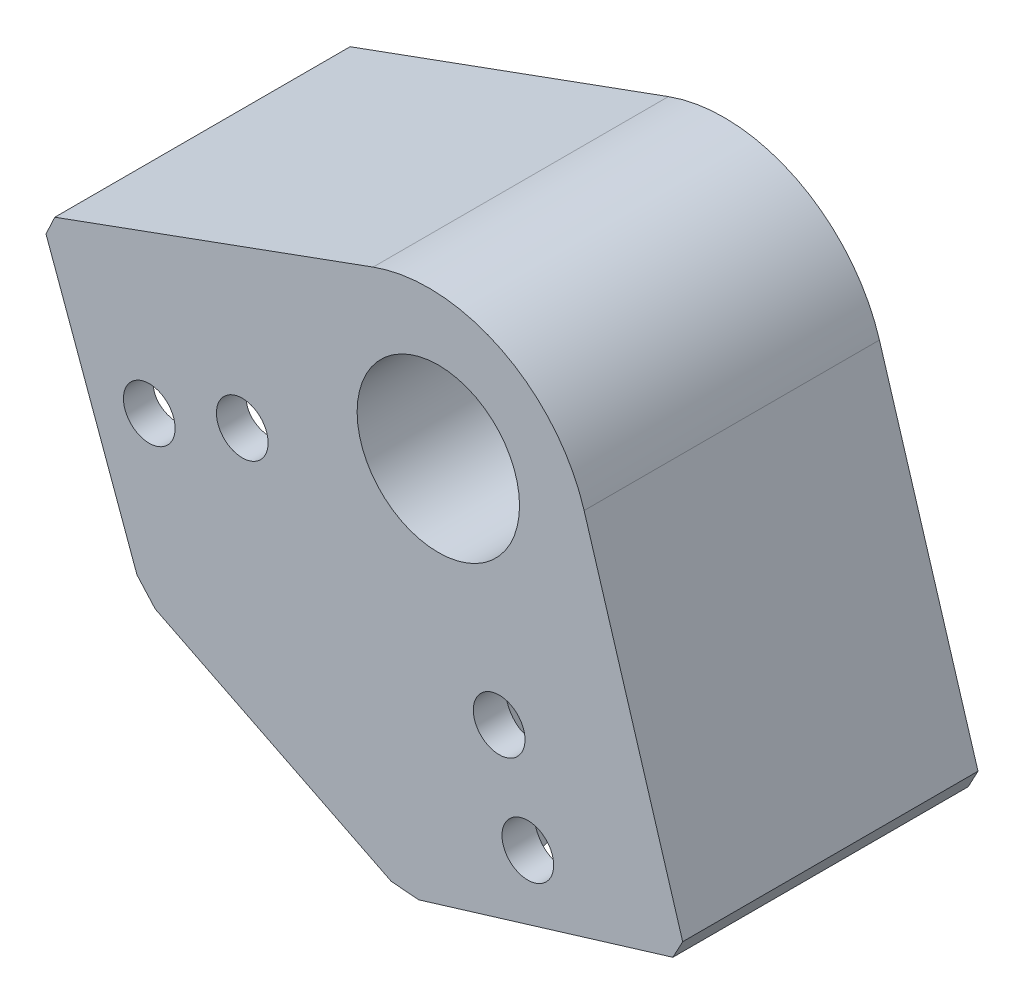
from build123d import *

# Parameters (mm, degrees)
BOSS_EXTRUDE1_DEPTH = 40
SKETCH2_R           = 16
CUT_EXTRUDE1_DEPTH  = 30
SKETCH3_R           = 16
CUT_EXTRUDE2_DEPTH  = 30
CUT_EXTRUDE3_REACH  = 87.885
SKETCH4_R           = 3.5
SKETCH6_W           = 97.811122408
SKETCH6_H           = 40
BOSS_EXTRUDE2_DEPTH = 30
SKETCH5_R           = 11
CUT_EXTRUDE4_DEPTH  = 40
CUT_EXTRUDE7_DEPTH  = 40
FILLET1_R           = 22
CHAMFER1_SIZE       = 2
CHAMFER2_SIZE       = 2


with BuildPart() as part:
    # Sketch1 → Boss-Extrude1 (new body)
    with BuildSketch(Plane.XY):
        Polygon((-40.424029814, 28.51734538), (47.085187233, -15.176505431), (33.683689612, -42.016771106), (-53.825527435, 1.677079705), align=None)
        Polygon((-53.825527435, 1.677079705), (33.683689612, -42.016771106), (-4.585446216, -53.656068464), (-40.133712767, -35.906616376), align=None)
    extrude(amount=BOSS_EXTRUDE1_DEPTH)

    # Sketch2 → Cut-Extrude1 (cut)
    with BuildSketch(Plane(origin=(14.549121698, -47.836419785, 0), x_dir=(-0.9567283956954932, -0.29098243395423, 0), z_dir=(0.29098243395423, -0.9567283956954933, 0))):
        with Locations(Location((0, -20, 0), (0, 0, 180))):
            Circle(SKETCH2_R)
    extrude(amount=-CUT_EXTRUDE1_DEPTH, mode=Mode.SUBTRACT)

    # Sketch3 → Cut-Extrude2 (cut)
    with BuildSketch(Plane(origin=(-46.979620101, -17.114768336, 0), x_dir=(0, 0, 1), z_dir=(-0.939592402016652, -0.342295366712111, 0))):
        with Locations(Location((20, 0, 0), (0, 0, 270))):
            Circle(SKETCH3_R)
    extrude(amount=-CUT_EXTRUDE2_DEPTH, mode=Mode.SUBTRACT)

    # Cut-Extrude3: up to this face of the body (flat: up to its plane)
    cut_extrude3_end = Plane(part.part.faces().sort_by_distance((-8.066388037, -16.155209221, 40))[0])
    # Sketch4 → Cut-Extrude3 (cut, up to the picked face)
    with BuildSketch(Plane(origin=(0, 0, 0), x_dir=(-1, 0, 0), z_dir=(0, 0, -1)), mode=Mode.PRIVATE) as cut_extrude3_sk1:
        with Locations((-8.241246184, -27.096598695)):
            Circle(SKETCH4_R)
    cut_extrude3_tool1 = split(extrude(cut_extrude3_sk1.sketch, amount=-CUT_EXTRUDE3_REACH, mode=Mode.PRIVATE), bisect_by=cut_extrude3_end, keep=Keep.BOTH, mode=Mode.PRIVATE)
    # Sketch4 → Cut-Extrude3 (cut, up to the picked face)
    with BuildSketch(Plane(origin=(0, 0, 0), x_dir=(-1, 0, 0), z_dir=(0, 0, -1)), mode=Mode.PRIVATE) as cut_extrude3_sk2:
        with Locations((-12.125238023, -39.866872249)):
            Circle(SKETCH4_R)
    cut_extrude3_tool2 = split(extrude(cut_extrude3_sk2.sketch, amount=-CUT_EXTRUDE3_REACH, mode=Mode.PRIVATE), bisect_by=cut_extrude3_end, keep=Keep.BOTH, mode=Mode.PRIVATE)
    # Sketch4 → Cut-Extrude3 (cut, up to the picked face)
    with BuildSketch(Plane(origin=(0, 0, 0), x_dir=(-1, 0, 0), z_dir=(0, 0, -1)), mode=Mode.PRIVATE) as cut_extrude3_sk3:
        with Locations((26.555072549, -9.674065347)):
            Circle(SKETCH4_R)
    cut_extrude3_tool3 = split(extrude(cut_extrude3_sk3.sketch, amount=-CUT_EXTRUDE3_REACH, mode=Mode.PRIVATE), bisect_by=cut_extrude3_end, keep=Keep.BOTH, mode=Mode.PRIVATE)
    # Sketch4 → Cut-Extrude3 (cut, up to the picked face)
    with BuildSketch(Plane(origin=(0, 0, 0), x_dir=(-1, 0, 0), z_dir=(0, 0, -1)), mode=Mode.PRIVATE) as cut_extrude3_sk4:
        with Locations((39.152815392, -14.263447931)):
            Circle(SKETCH4_R)
    cut_extrude3_tool4 = split(extrude(cut_extrude3_sk4.sketch, amount=-CUT_EXTRUDE3_REACH, mode=Mode.PRIVATE), bisect_by=cut_extrude3_end, keep=Keep.BOTH, mode=Mode.PRIVATE)
    add(cut_extrude3_tool1.solids().sort_by(Axis((8.241246, -27.096599, 0), (0, 0, 1)))[0], mode=Mode.SUBTRACT)
    add(cut_extrude3_tool2.solids().sort_by(Axis((12.125238, -39.866872, 0), (0, 0, 1)))[0], mode=Mode.SUBTRACT)
    add(cut_extrude3_tool3.solids().sort_by(Axis((-26.555073, -9.674065, 0), (0, 0, 1)))[0], mode=Mode.SUBTRACT)
    add(cut_extrude3_tool4.solids().sort_by(Axis((-39.152815, -14.263448, 0), (0, 0, 1)))[0], mode=Mode.SUBTRACT)

    # Sketch6 → Boss-Extrude2 (add)
    with BuildSketch(Plane(origin=(3.33057871, 6.670419974, 0), x_dir=(0.8946755224974542, -0.4467165873838887, 0), z_dir=(0.4467165873838887, 0.8946755224974542, 0))):
        with Locations((0, -20)):
            Rectangle(SKETCH6_W, SKETCH6_H)
    extrude(amount=BOSS_EXTRUDE2_DEPTH)

    # Sketch5 → Cut-Extrude4 (cut)
    with BuildSketch(Plane(origin=(0, 0, 0), x_dir=(-1, 0, 0), z_dir=(0, 0, -1))):
        Circle(SKETCH5_R)
    extrude(amount=-CUT_EXTRUDE4_DEPTH, mode=Mode.SUBTRACT)

    # Sketch7 → Cut-Extrude7 (cut)
    with BuildSketch(Plane(origin=(0, 0, 0), x_dir=(-1, 0, 0), z_dir=(0, 0, -1))):
        Polygon((-60.486684855, 11.663760244), (-33.683689612, -42.016771106), (-12.991209784, 26.018548963), (-23.829432932, 29.966935049), align=None)
        Polygon((-23.829432932, 29.966935049), (-12.991209784, 26.018548963), (-9.634719731, 37.05443625), align=None)
        Polygon((-9.634719731, 37.05443625), (-12.991209784, 26.018548963), (53.825527435, 1.677079705), (27.022532192, 55.357611055), align=None)
    extrude(amount=-CUT_EXTRUDE7_DEPTH, mode=Mode.SUBTRACT)

    # Fillet1
    fillet1_edges = [part.edges().sort_by_distance(p)[0] for p in [
        (12.991209784, 26.018548963, 20),
    ]]
    fillet(fillet1_edges, radius=FILLET1_R)

    # Chamfer1
    chamfer1_edges = [part.edges().sort_by_distance(p)[0] for p in [
        (33.683689612, -42.016771106, 20),
        (-53.825527435, 1.677079705, 20),
    ]]
    chamfer(chamfer1_edges, length=CHAMFER1_SIZE)

    # Chamfer2
    chamfer2_edges = [part.edges().sort_by_distance(p)[0] for p in [
        (-4.585446216, -53.656068464, 20),
        (-40.133712767, -35.906616376, 20),
    ]]
    chamfer(chamfer2_edges, length=CHAMFER2_SIZE)


solid = part.part
